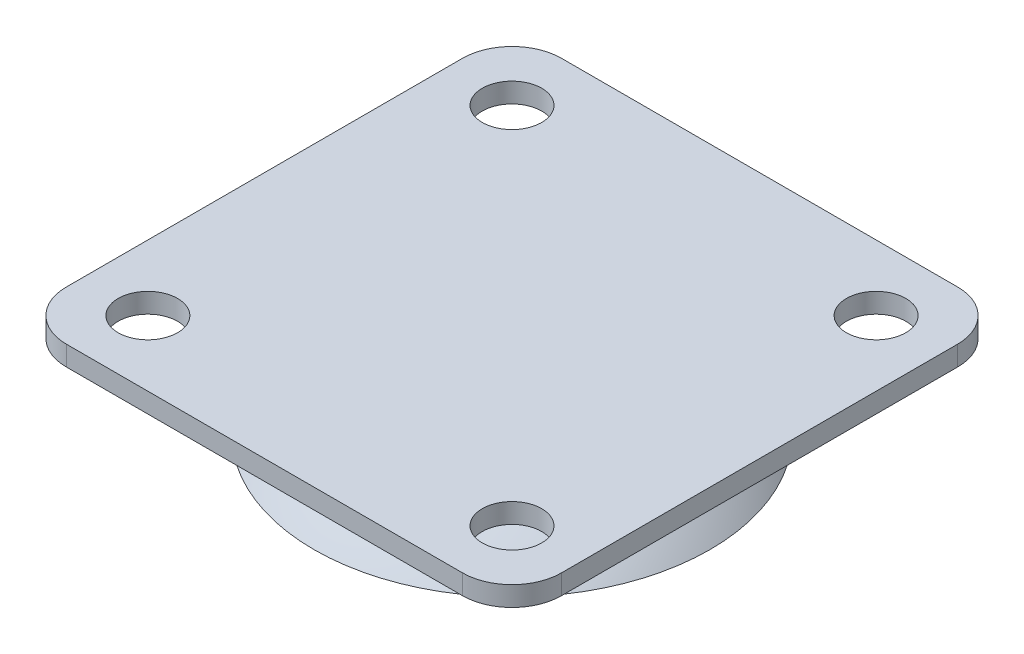
from build123d import *

# Parameters (mm, degrees)
SKETCH1_W           = 50
SKETCH1_H           = 50
SKETCH1_R           = 3
BOSS_EXTRUDE1_DEPTH = 2
FILLET1_R           = 5


with BuildPart() as part:
    # Sketch1 → Boss-Extrude1 (new body)
    with BuildSketch(Plane(origin=(0, 0, 0), x_dir=(1, 0, 0), z_dir=(0, 1, 0))):
        Rectangle(SKETCH1_W, SKETCH1_H)
        with Locations(Location((18.384776311, 18.384776311, 0), (0, 0, 270))):
            Circle(SKETCH1_R, mode=Mode.SUBTRACT)
        with Locations(Location((-18.384776311, 18.384776311, 0), (0, 0, 90))):
            Circle(SKETCH1_R, mode=Mode.SUBTRACT)
        with Locations(Location((18.384776311, -18.384776311, 0), (0, 0, 90))):
            Circle(SKETCH1_R, mode=Mode.SUBTRACT)
        with Locations(Location((-18.384776311, -18.384776311, 0), (0, 0, 270))):
            Circle(SKETCH1_R, mode=Mode.SUBTRACT)
    extrude(amount=BOSS_EXTRUDE1_DEPTH)

    # Fillet1
    fillet1_edges = [part.edges().sort_by_distance(p)[0] for p in [
        (25, 1, 25),
        (-25, 1, 25),
        (-25, 1, -25),
        (25, 1, -25),
    ]]
    fillet(fillet1_edges, radius=FILLET1_R)


with BuildPart() as body_2:
    # Sketch2 → Revolve1 (revolve)
    with BuildSketch(Plane.XY):
        with BuildLine():
            Line((0, -2.019980921), (1.99930643, -2.072647775))
            add(Edge.make_bspline(
                [(1.99930643, -2.072647775), (2.666007666, -2.117291662), (4.014019168, -2.251616435), (6.549499982, -2.683388344), (9.525407915, -3.533799384), (12.765394617, -5.035648817), (14.749449818, -6.380365871), (15.679001727, -7.124399167)],
                knots=[0.08723148, 0.08723148, 0.08723148, 0.08723148, 0.177417467, 0.267603454, 0.447975427, 0.628347401, 0.808719374, 0.808719374, 0.808719374, 0.808719374], degree=3))
            Line((15.679001727, -7.124399167), (17.160402388, -8.468070288))
            Line((17.160402388, -8.468070288), (20, -8.468070288))
            add(Edge.make_bspline(
                [(0, 0), (12.43840622, -0.079628335), (20, -8.468070288)],
                knots=[0, 0, 0, 1, 1, 1], degree=2))
            Line((0, 0), (0, -2.019980921))
        make_face()
    revolve(axis=Axis((0, 10.005953766, 0), (0, -1, 0)))


solid = Compound([part.part, body_2.part])
